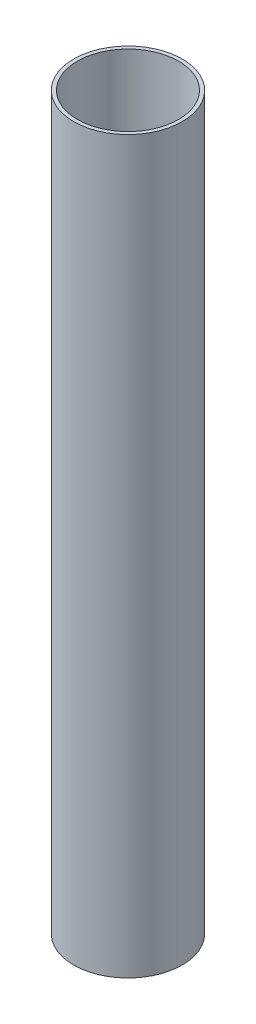
from build123d import *

# Parameters (mm, degrees)
SKETCH1_R           = 20.7518
SKETCH1_R_2         = 19.3548
BOSS_EXTRUDE1_DEPTH = 279.4


with BuildPart() as part:
    # Sketch1 → Boss-Extrude1 (new body)
    with BuildSketch(Plane(origin=(0, 0, 0), x_dir=(1, 0, 0), z_dir=(0, 1, 0))):
        with Locations(Location((0, 0, 0), (0, 0, 270))):
            Circle(SKETCH1_R)
        with Locations(Location((0, 0, 0), (0, 0, 270))):
            Circle(SKETCH1_R_2, mode=Mode.SUBTRACT)
    extrude(amount=BOSS_EXTRUDE1_DEPTH)


solid = part.part
